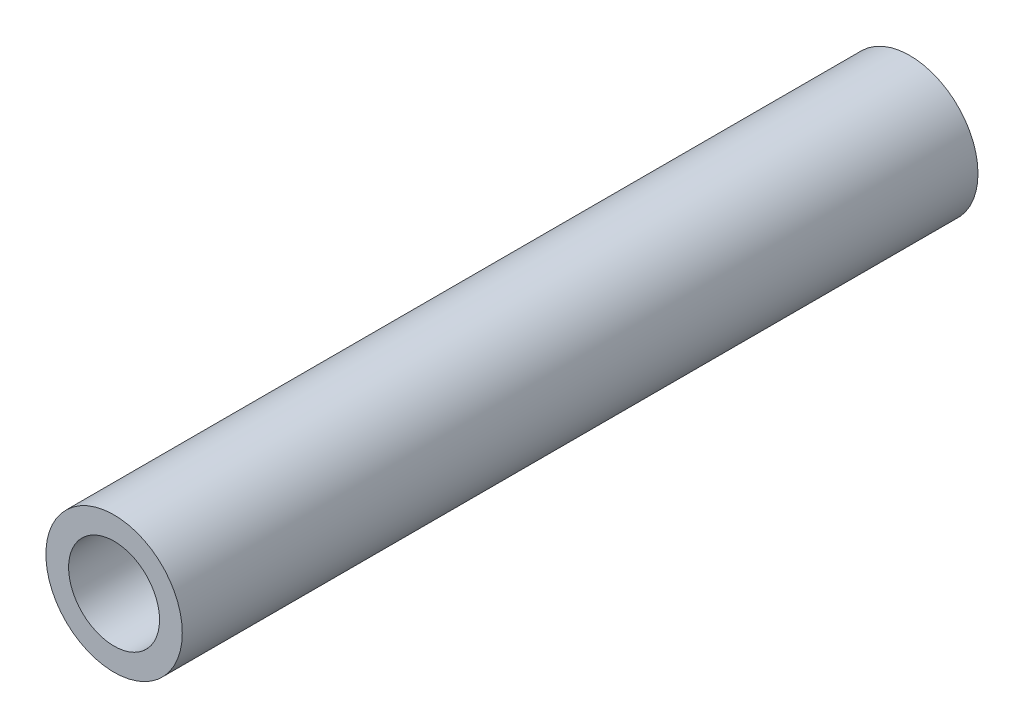
from build123d import *

# Parameters (mm, degrees)
SKETCH1_R           = 3
BOSS_EXTRUDE1_DEPTH = 35
SKETCH2_R           = 2
CUT_EXTRUDE1_DEPTH  = 30


with BuildPart() as part:
    # Sketch1 → Boss-Extrude1 (new body)
    with BuildSketch(Plane.XY):
        with Locations((6, 6)):
            Circle(SKETCH1_R)
    extrude(amount=BOSS_EXTRUDE1_DEPTH)

    # Sketch2 → Cut-Extrude1 (cut)
    with BuildSketch(Plane.XY.offset(35)):
        with Locations((6, 6)):
            Circle(SKETCH2_R)
    extrude(amount=-CUT_EXTRUDE1_DEPTH, mode=Mode.SUBTRACT)


solid = part.part
